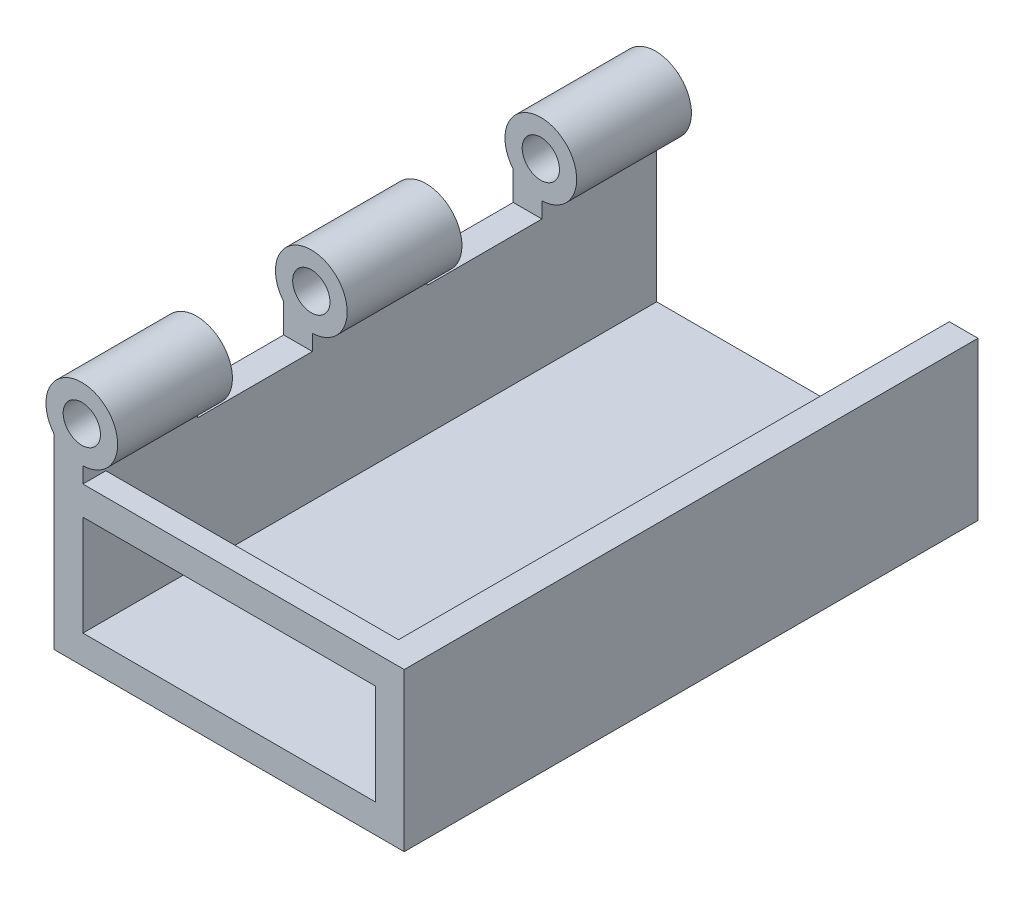
from build123d import *

# Parameters (mm, degrees)
BATTERY_WALL_DEPTH  = 13.97
SKETCH1_4_W         = 25.908
SKETCH1_4_H         = 48.768
BATTERY_BASE_DEPTH  = 2.54
SKETCH3_W           = 25.908
SKETCH3_H           = 8.89
BATTERY_GAP_DEPTH   = 2.54
SKETCH4_R           = 1.651
BATTERY_HINGE_DEPTH = 10.16
LPATTERN1_COUNT     = 3
LPATTERN1_PITCH     = 20.32


with BuildPart() as part:
    # Sketch1 → battery-wall (new body)
    with BuildSketch(Plane(origin=(0, 0, 0), x_dir=(1, 0, 0), z_dir=(0, 1, 0))):
        Polygon((-12.954, -24.384), (-12.954, 24.384), (-15.494, 24.384), (-15.494, -26.416), (15.494, -26.416), (15.494, 24.384), (12.954, 24.384), (12.954, -24.384), align=None)
    extrude(amount=BATTERY_WALL_DEPTH)

    # Sketch1<4> → battery-base (add)
    with BuildSketch(Plane(origin=(0, 0, 0), x_dir=(1, 0, 0), z_dir=(0, 1, 0))):
        Rectangle(SKETCH1_4_W, SKETCH1_4_H)
    extrude(amount=BATTERY_BASE_DEPTH)

    # Sketch3 → battery-gap (cut)
    with BuildSketch(Plane.XY.offset(26.416)):
        with Locations((0, 6.985)):
            Rectangle(SKETCH3_W, SKETCH3_H)
    extrude(amount=-BATTERY_GAP_DEPTH, mode=Mode.SUBTRACT)

    # Sketch4 → battery-hinge (add)
    with BuildSketch(Plane.XY.offset(26.416)):
        with BuildLine():
            Line((-15.494, 16.51), (-15.494, 13.97))
            Line((-15.494, 13.97), (-12.954, 13.97))
            Line((-12.954, 13.97), (-12.954, 15.366140824))
            ThreePointArc((-12.954, 15.366140824), (-11.748702854, 21.434599078), (-15.494, 16.51))
        make_face()
        with Locations((-13.052425, 18.53961487)):
            Circle(SKETCH4_R, mode=Mode.SUBTRACT)
    battery_hinge = extrude(amount=-BATTERY_HINGE_DEPTH)

    # LPattern1: battery-hinge ×3
    with Locations(*[(0, 0, -i * LPATTERN1_PITCH) for i in range(1, LPATTERN1_COUNT)]):
        add(battery_hinge)


solid = part.part
